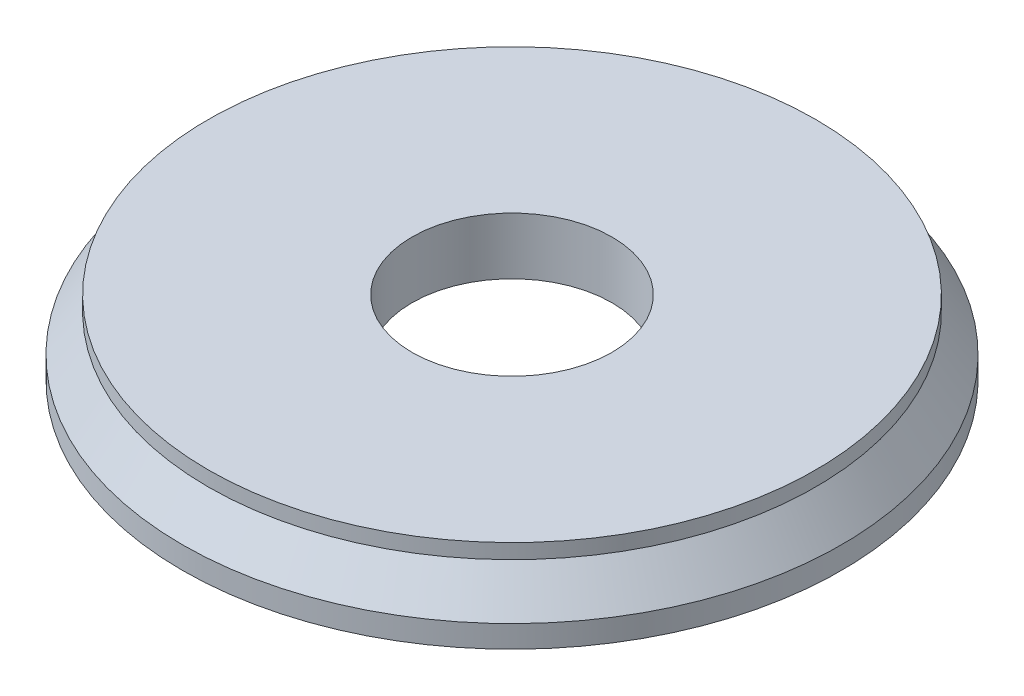
from build123d import *

# Parameters (mm, degrees)
CHAMFER_1_SIZE  = 4
CHAMFER_1_SIZE2 = 2.309401077


with BuildPart() as part:
    # Эскиз1 → Повернуть1 (revolve)
    with BuildSketch(Plane.XY, mode=Mode.PRIVATE) as revolve_1_sk:
        Polygon((13.5, 0), (44.5, 0), (44.5, 3), (41, 8), (41, 10), (13.5, 10), align=None)
    revolve(revolve_1_sk.sketch.rotate(Axis((0, 0, 0), (0, 1, 0)), 90), axis=Axis((0, 0, 0), (0, 1, 0)))

    # Фаска1
    chamfer_1_edges = [part.edges().sort_by_distance(p)[0] for p in [
        (0, 0, 13.5),
    ]]
    chamfer_1_side = [part.faces().sort_by_distance(p)[0] for p in [
        (0, 0, 14.758650071),
    ]]
    chamfer(chamfer_1_edges, length=CHAMFER_1_SIZE, length2=CHAMFER_1_SIZE2, reference=chamfer_1_side[0])


solid = part.part
